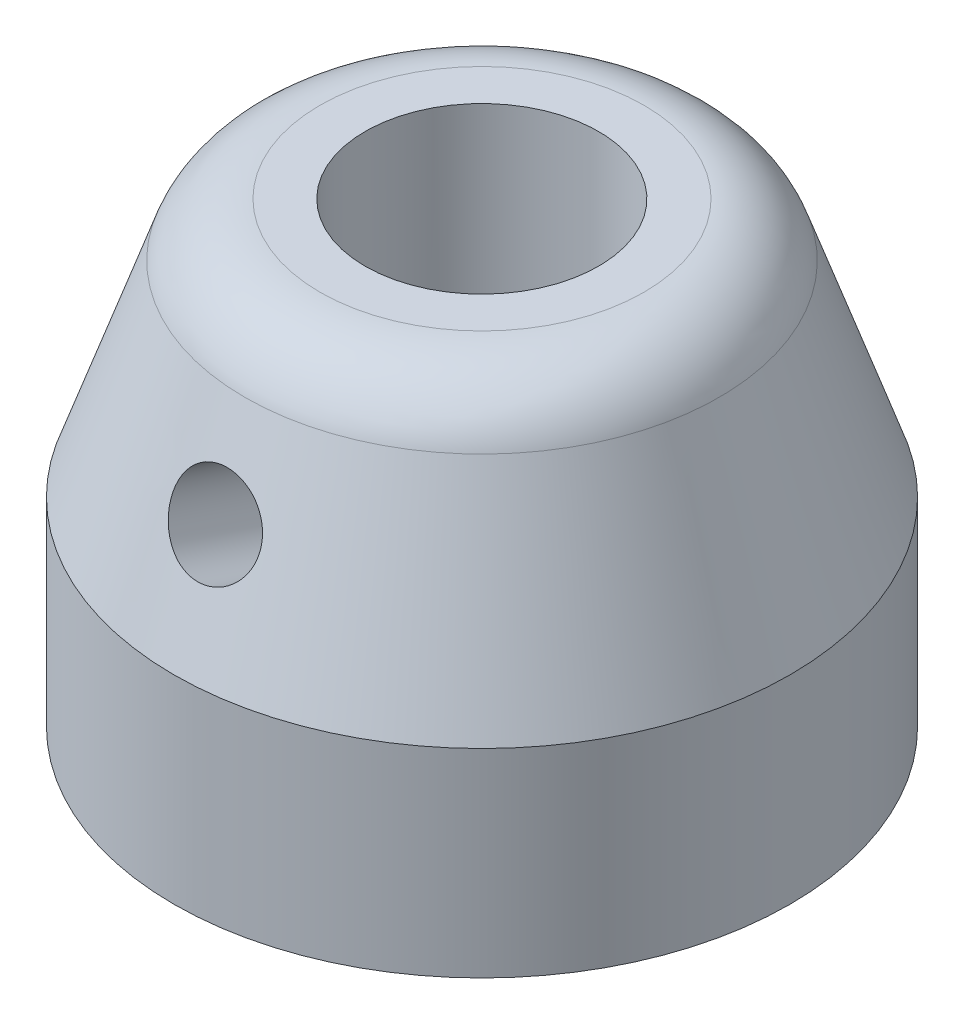
from build123d import *

# Parameters (mm, degrees)
M25X1_5_DI_LI_DELIK1_D     = 23.5
RADYUS1_R                  = 8
M10X1_0_DI_LI_DELIK2_D     = 9
M10X1_0_DI_LI_DELIK2_DEPTH = 10
M10X1_0_DI_LI_DELIK2_TIP   = 2.703872786


with BuildPart() as part:
    # Çizim1 → Döndür1 (revolve)
    with BuildSketch(Plane.XY, mode=Mode.PRIVATE) as d_nd_r1_sk:
        Polygon((0, 46), (0, 0), (31, 0), (31, 20), (22, 46), align=None)
    revolve(d_nd_r1_sk.sketch.rotate(Axis((0, 46, 0), (0, -1, 0)), 90), axis=Axis((0, 46, 0), (0, -1, 0)))

    # M25x1.5 Dişli Delik1 (through all)
    with Locations(Plane(origin=(0.000913764, 46, 0.015948363), x_dir=(0, 0, 1), z_dir=(0, 1, 0))):
        with Locations((0, 0)):
            Hole(M25X1_5_DI_LI_DELIK1_D / 2)

    # Radyus1
    radyus1_edges = [part.edges().sort_by_distance(p)[0] for p in [
        (0, 46, -22),
    ]]
    fillet(radyus1_edges, radius=RADYUS1_R)

    # M10x1.0 Dişli Delik2
    with Locations(Plane(origin=(0, 11.722589168, 33.865257596), x_dir=(1, 0, 0), z_dir=(0, 0.32711056388316634, 0.9449860734402582))):
        with Locations((0, 20.576424516)):
            Hole(M10X1_0_DI_LI_DELIK2_D / 2, depth=M10X1_0_DI_LI_DELIK2_DEPTH)
            with Locations((0, 0, -(M10X1_0_DI_LI_DELIK2_DEPTH + M10X1_0_DI_LI_DELIK2_TIP / 2))):  # 118° drill point
                Cone(0, M10X1_0_DI_LI_DELIK2_D / 2, M10X1_0_DI_LI_DELIK2_TIP, mode=Mode.SUBTRACT)

    # Çizim14 → Kes-Döndür1 (revolve, cut)
    with BuildSketch(Plane(origin=(0, 0, 0), x_dir=(0, 0, -1), z_dir=(1, 0, 0))):
        with BuildLine():
            Line((0, 0), (-18.203352341, 0))
            ThreePointArc((-18.203352341, 0), (-15.384211427, 1.092780017), (-12.5, 2))
            Line((-12.5, 2), (0, 2))
            Line((0, 2), (0, 0))
        make_face()
    revolve(axis=Axis((0, 0, 0), (0, 1, 0)), mode=Mode.SUBTRACT)


solid = part.part
